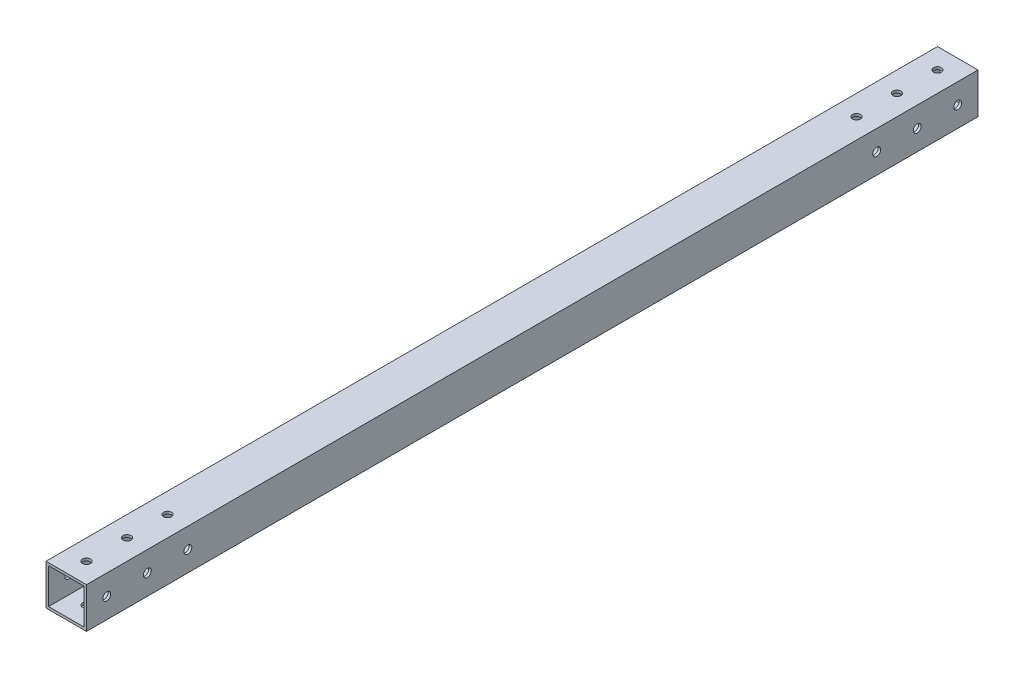
from build123d import *

# Parameters (mm, degrees)
SKETCH1_W           = 25.4
SKETCH1_H           = 25.4
BOSS_EXTRUDE1_DEPTH = 279.4
SHELL1_T            = -1.5875
SKETCH2_R           = 2.4892
CUT_EXTRUDE1_DEPTH  = 282.699627263
SKETCH3_R           = 2.4892
CUT_EXTRUDE2_DEPTH  = 282.699627263


with BuildPart() as part:
    # Sketch1 → Boss-Extrude1 (new, symmetric)
    with BuildSketch(Plane.XY):
        with Locations((12.7, 12.7)):
            Rectangle(SKETCH1_W, SKETCH1_H)
    extrude(amount=BOSS_EXTRUDE1_DEPTH, both=True)

    # Shell1
    shell1_openings = [part.faces().sort_by_distance(p)[0] for p in [
        (12.7, 12.7, 279.4),
        (12.7, 12.7, -279.4),
    ]]
    offset(amount=SHELL1_T, openings=shell1_openings, kind=Kind.INTERSECTION)

    # Sketch2 → Cut-Extrude1 (cut, through all)
    with BuildSketch(Plane(origin=(0, 25.4, 0), x_dir=(1, 0, 0), z_dir=(0, 1, 0))):
        with Locations(Location((12.7, -266.7, 0), (0, 0, 270))):
            Circle(SKETCH2_R)
        with Locations(Location((12.7, -241.3, 0), (0, 0, 270))):
            Circle(SKETCH2_R)
        with Locations(Location((12.7, -215.9, 0), (0, 0, 270))):
            Circle(SKETCH2_R)
    cut_extrude1 = extrude(amount=-CUT_EXTRUDE1_DEPTH, mode=Mode.SUBTRACT)

    # Sketch3 → Cut-Extrude2 (cut, through all)
    with BuildSketch(Plane.ZY):
        with Locations(Location((266.7, 12.7, 0), (0, 0, 270))):
            Circle(SKETCH3_R)
        with Locations(Location((241.3, 12.7, 0), (0, 0, 270))):
            Circle(SKETCH3_R)
        with Locations(Location((215.9, 12.7, 0), (0, 0, 270))):
            Circle(SKETCH3_R)
    cut_extrude2 = extrude(amount=-CUT_EXTRUDE2_DEPTH, mode=Mode.SUBTRACT)

    # Mirror1: Cut-Extrude1, Cut-Extrude2 across plane
    add(cut_extrude1.mirror(Plane.XY), mode=Mode.SUBTRACT)
    add(cut_extrude2.mirror(Plane.XY), mode=Mode.SUBTRACT)


solid = part.part
